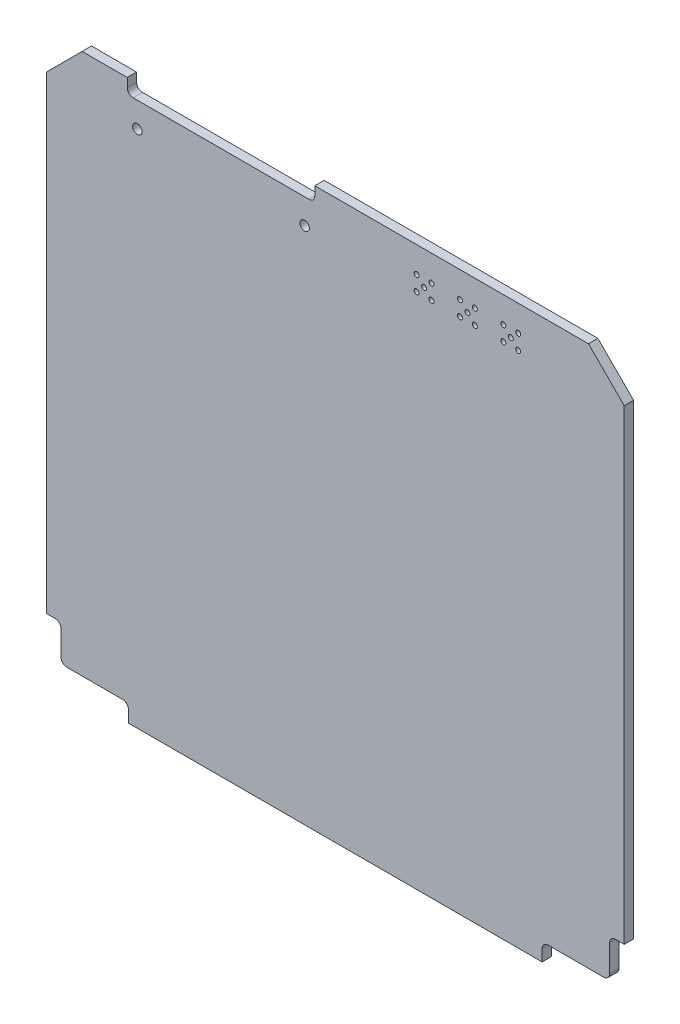
from build123d import *

# Parameters (mm, degrees)
SKETCH1_R           = 0.425
SKETCH1_R_2         = 0.8
BOSS_EXTRUDE1_DEPTH = 1.6


with BuildPart() as part:
    # Sketch1 → Boss-Extrude1 (new body)
    with BuildSketch(Plane(origin=(0, 0, -0.0125), x_dir=(-1, 0, 0), z_dir=(0, 0, -1))):
        with BuildLine():
            Line((47.8, -40.8), (49.3, -40.8))
            Line((49.3, -40.8), (49.3, 39.2))
            Line((49.3, 39.2), (43.2, 45.3))
            Line((43.2, 45.3), (35.500000017, 45.3))
            Line((35.500000017, 45.3), (35.500000017, 43.8))
            ThreePointArc((35.500000017, 43.8), (35.207106799, 43.092893219), (34.500000017, 42.8))
            Line((34.500000017, 42.8), (4.500000014, 42.8))
            ThreePointArc((4.500000014, 42.8), (3.792893232, 43.092893219), (3.500000014, 43.8))
            Line((3.500000014, 43.8), (3.500000014, 45.3))
            Line((3.500000014, 45.3), (-43.2, 45.3))
            Line((-43.2, 45.3), (-49.3, 39.2))
            Line((-49.3, 39.2), (-49.3, -40.4))
            Line((-49.3, -40.4), (-47.8, -40.4))
            ThreePointArc((-47.8, -40.4), (-47.092893219, -40.692893219), (-46.8, -41.4))
            Line((-46.8, -41.4), (-46.8, -46))
            ThreePointArc((-46.8, -46), (-46.507106781, -46.707106781), (-45.8, -47))
            Line((-45.8, -47), (-36.3, -47))
            ThreePointArc((-36.3, -47), (-35.592893219, -47.292893219), (-35.3, -48))
            Line((-35.3, -48), (-35.3, -50))
            Line((-35.3, -50), (35.3, -50))
            Line((35.3, -50), (35.3, -48))
            ThreePointArc((35.3, -48), (35.592893219, -47.292893219), (36.3, -47))
            Line((36.3, -47), (45.8, -47))
            ThreePointArc((45.8, -47), (46.507106781, -46.707106781), (46.8, -46))
            Line((46.8, -46), (46.8, -41.8))
            ThreePointArc((46.8, -41.8), (47.092893219, -41.092893219), (47.8, -40.8))
        make_face()
        with Locations(Location((-13.87, 38.33, 0), (0, 0, 180))):
            Circle(SKETCH1_R, mode=Mode.SUBTRACT)
        with Locations(Location((-22.54, 39.6, 0), (0, 0, 180))):
            Circle(SKETCH1_R, mode=Mode.SUBTRACT)
        with Locations(Location((-23.81, 40.87, 0), (0, 0, 180))):
            Circle(SKETCH1_R, mode=Mode.SUBTRACT)
        with Locations(Location((-21.27, 40.87, 0), (0, 0, 180))):
            Circle(SKETCH1_R, mode=Mode.SUBTRACT)
        with Locations(Location((-13.87, 40.87, 0), (0, 0, 180))):
            Circle(SKETCH1_R, mode=Mode.SUBTRACT)
        with Locations(Location((-31.21, 40.87, 0), (0, 0, 180))):
            Circle(SKETCH1_R, mode=Mode.SUBTRACT)
        with Locations(Location((-16.41, 40.87, 0), (0, 0, 180))):
            Circle(SKETCH1_R, mode=Mode.SUBTRACT)
        with Locations(Location((-15.14, 39.6, 0), (0, 0, 180))):
            Circle(SKETCH1_R, mode=Mode.SUBTRACT)
        with Locations(Location((-29.94, 39.6, 0), (0, 0, 180))):
            Circle(SKETCH1_R, mode=Mode.SUBTRACT)
        with Locations(Location((-28.67, 40.87, 0), (0, 0, 180))):
            Circle(SKETCH1_R, mode=Mode.SUBTRACT)
        with Locations(Location((-28.67, 38.33, 0), (0, 0, 180))):
            Circle(SKETCH1_R, mode=Mode.SUBTRACT)
        with Locations(Location((-16.41, 38.33, 0), (0, 0, 180))):
            Circle(SKETCH1_R, mode=Mode.SUBTRACT)
        with Locations(Location((-21.27, 38.33, 0), (0, 0, 180))):
            Circle(SKETCH1_R, mode=Mode.SUBTRACT)
        with Locations(Location((-23.81, 38.33, 0), (0, 0, 180))):
            Circle(SKETCH1_R, mode=Mode.SUBTRACT)
        with Locations(Location((-31.21, 38.33, 0), (0, 0, 180))):
            Circle(SKETCH1_R, mode=Mode.SUBTRACT)
        with Locations((33.775, 38.54)):
            Circle(SKETCH1_R_2, mode=Mode.SUBTRACT)
        with Locations((5.225, 38.54)):
            Circle(SKETCH1_R_2, mode=Mode.SUBTRACT)
    extrude(amount=-BOSS_EXTRUDE1_DEPTH)


solid = part.part
